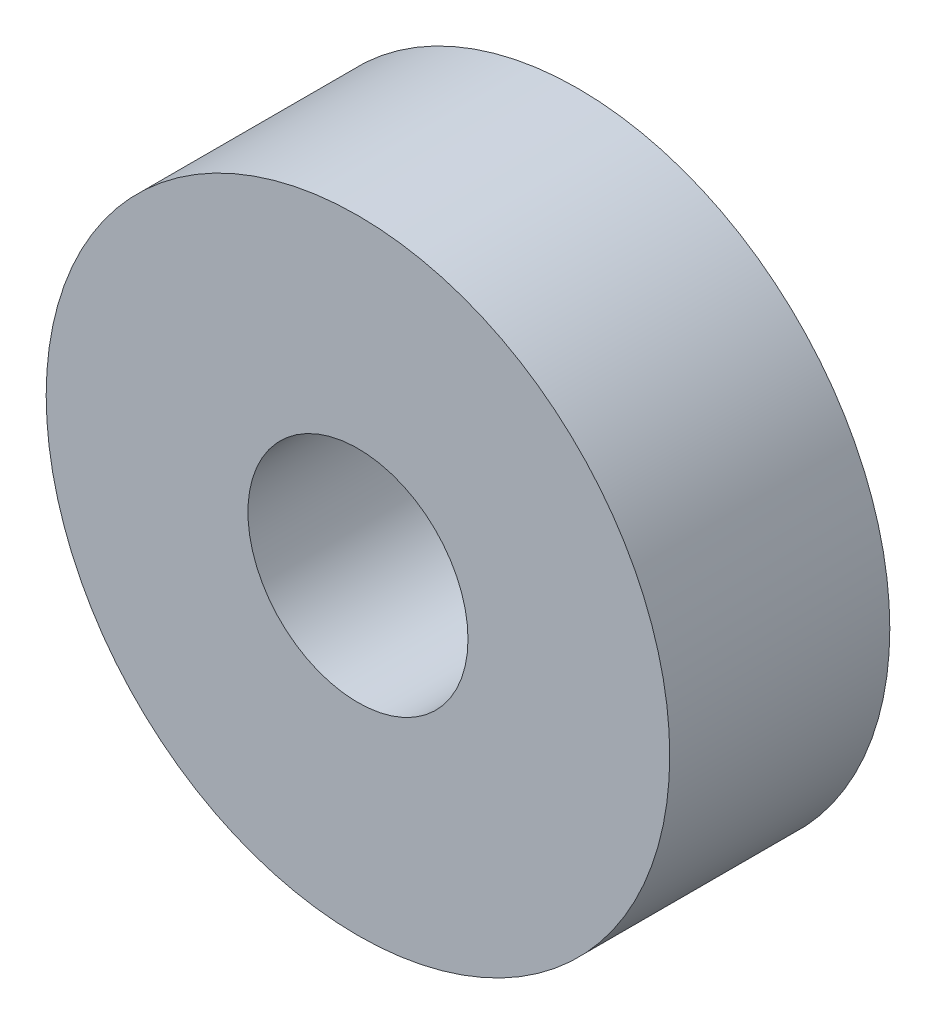
from build123d import *

# Parameters (mm, degrees)
SKETCH1_R           = 8.5
BOSS_EXTRUDE1_DEPTH = 6
SKETCH2_R           = 3
CUT_EXTRUDE1_DEPTH  = 14.435028843


with BuildPart() as part:
    # Sketch1 → Boss-Extrude1 (new body)
    with BuildSketch(Plane.XY):
        Circle(SKETCH1_R)
    extrude(amount=BOSS_EXTRUDE1_DEPTH)

    # Sketch2 → Cut-Extrude1 (cut, through all)
    with BuildSketch(Plane.XY.offset(6)):
        Circle(SKETCH2_R)
    extrude(amount=-CUT_EXTRUDE1_DEPTH, mode=Mode.SUBTRACT)


solid = part.part
